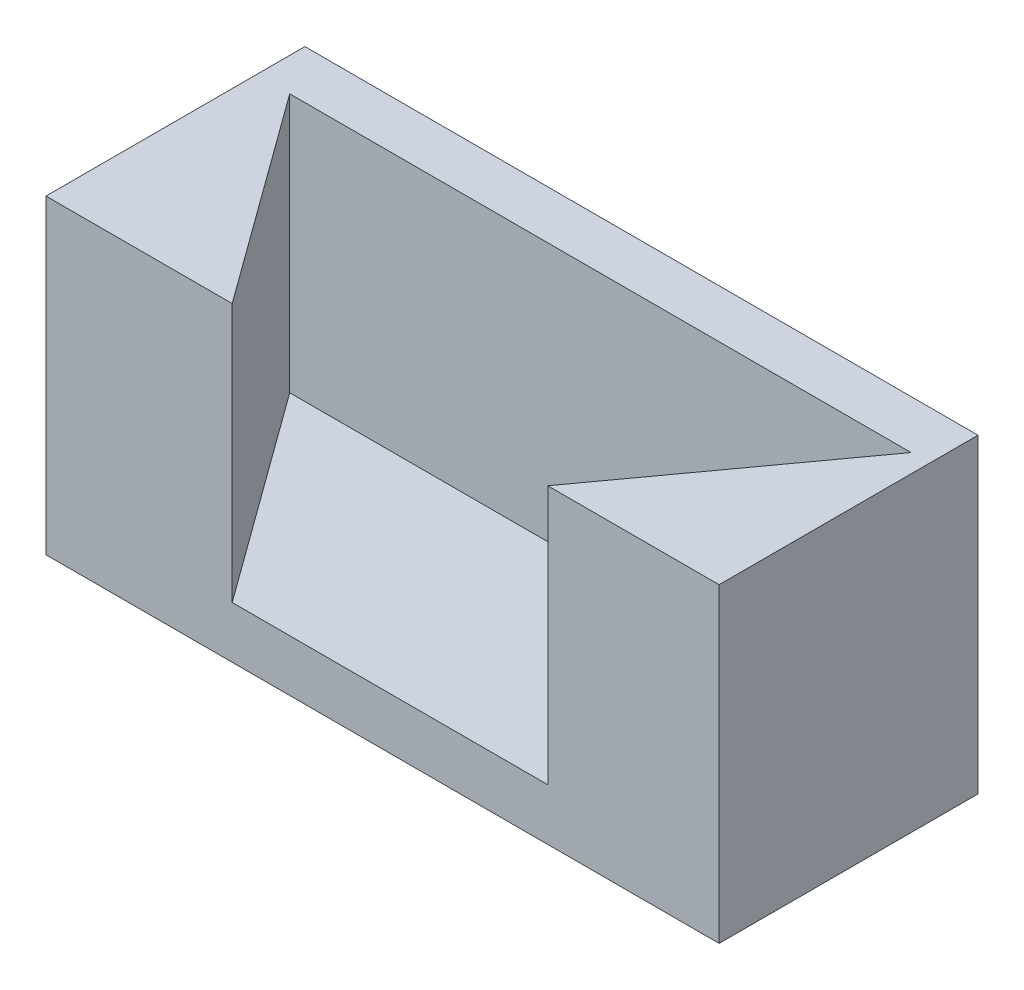
from build123d import *

# Parameters (mm, degrees)
SKETCH3_W           = 13
SKETCH3_H           = 5
BOSS_EXTRUDE2_DEPTH = 6
CUT_EXTRUDE2_DEPTH  = 5


with BuildPart() as part:
    # Sketch3 → Boss-Extrude2 (new body)
    with BuildSketch(Plane(origin=(0, 0, 0), x_dir=(1, 0, 0), z_dir=(0, 1, 0))):
        Rectangle(SKETCH3_W, SKETCH3_H)
    extrude(amount=BOSS_EXTRUDE2_DEPTH)

    # Sketch5 → Cut-Extrude2 (cut)
    with BuildSketch(Plane(origin=(0, 6, 0), x_dir=(1, 0, 0), z_dir=(0, 1, 0))):
        Polygon((-2.90419665, -2.5), (-5.856572924, 1.563597326), (6.143427076, 1.563597326), (3.191050802, -2.5), align=None)
    extrude(amount=-CUT_EXTRUDE2_DEPTH, mode=Mode.SUBTRACT)


solid = part.part
